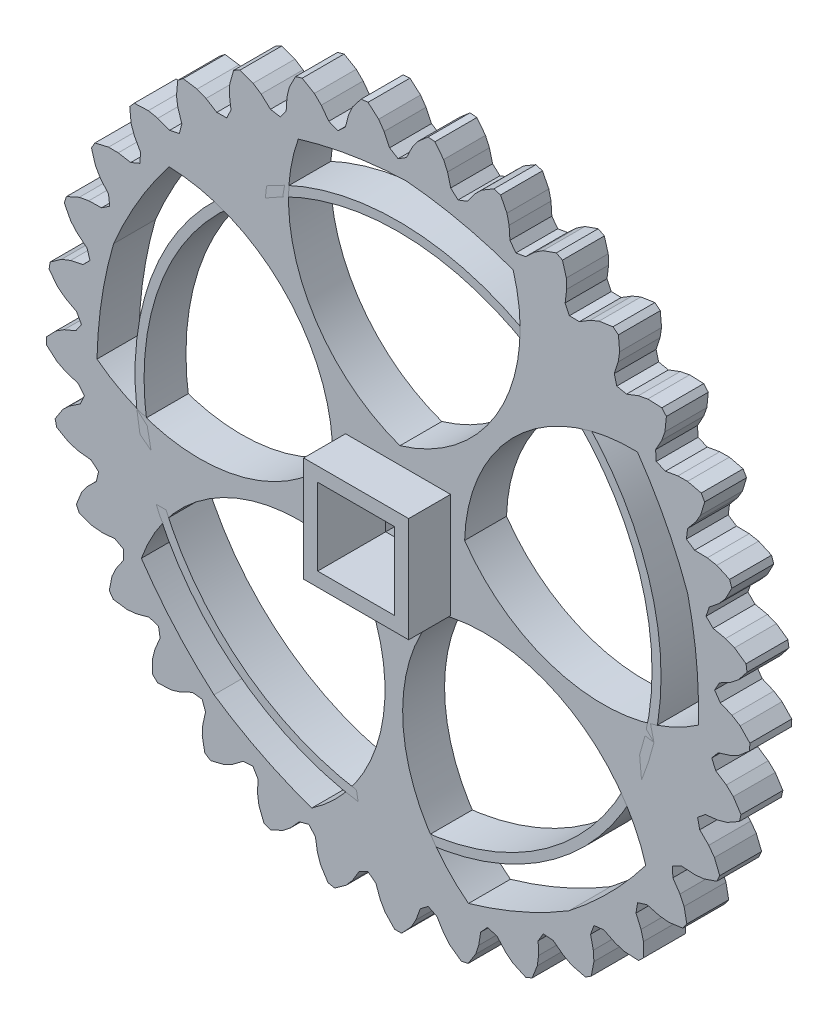
from build123d import *
from OCP.BRepFilletAPI import BRepFilletAPI_MakeChamfer

# Parameters (mm, degrees)
SKETCH1_R           = 33.61285714
SKETCH1_W           = 7.35
SKETCH1_H           = 7.35
BOSS_EXTRUDE1_DEPTH = 4
CUT_EXTRUDE1_DEPTH  = 48.703755934
CIRPATTERN1_COUNT   = 33
CUT_EXTRUDE2_DEPTH  = 48.686856373
SKETCH5_R           = 25.109802293
SKETCH5_R_2         = 24.249619568
BOSS_EXTRUDE2_DEPTH = 4
CIRPATTERN2_COUNT   = 5
CHAMFER1_SIZE       = 1.5
CHAMFER1_SIZE2      = 0.5
SKETCH6_W           = 10.02614
SKETCH6_H           = 10.02614
SKETCH6_W_2         = 7.35
SKETCH6_H_2         = 7.35
BOSS_EXTRUDE3_DEPTH = 4


with BuildPart() as part:
    # Sketch1 → Boss-Extrude1 (new body)
    with BuildSketch(Plane.XY):
        Circle(SKETCH1_R)
        Rectangle(SKETCH1_W, SKETCH1_H, mode=Mode.SUBTRACT)
    extrude(amount=BOSS_EXTRUDE1_DEPTH)

    # Sketch2 → Cut-Extrude1 (cut, through all)
    with BuildSketch(Plane.XY):
        Polygon((0, 30.26077862), (-0.806852748, 30.759138229), (-1.329964738, 31.848954875), (-1.855743872, 32.604561083), (-2.866453658, 33.490410695), (-1.855743872, 34.262942561), (0, 34.85886251), (1.855743872, 34.262942561), (2.866453658, 33.490410695), (1.855743872, 32.604561083), (1.329964738, 31.848954875), (0.806852748, 30.759138229), align=None)
    cut_extrude1 = extrude(amount=CUT_EXTRUDE1_DEPTH, mode=Mode.SUBTRACT)

    # CirPattern1: Cut-Extrude1 ×33 about axis
    cirpattern1_axis = Axis((0, 0, 0), (0, 0, 1))
    for i in range(1, CIRPATTERN1_COUNT):
        add(cut_extrude1.rotate(cirpattern1_axis, i * 360 / CIRPATTERN1_COUNT), mode=Mode.SUBTRACT)

    # Sketch4 → Cut-Extrude2 (cut, symmetric)
    with BuildSketch(Plane.XY):
        with BuildLine():
            ThreePointArc((0.785423622, 28.815229147), (-4.425906566, 28.309016937), (-9.526676446, 27.127340258))
            ThreePointArc((-9.526676446, 27.127340258), (-8.91966248, 14.864745864), (0.180524863, 6.623005904))
            ThreePointArc((0.180524863, 6.623005904), (9.716160759, 14.356784753), (10.990266096, 26.568105027))
            ThreePointArc((10.990266096, 26.568105027), (5.961440562, 28.025886521), (0.785423622, 28.815229147))
        make_face()
    cut_extrude2 = extrude(amount=CUT_EXTRUDE2_DEPTH, both=True, mode=Mode.SUBTRACT)

    # CirPattern2: Cut-Extrude2 ×5 about axis
    cirpattern2_axis = Axis((0, 0, 0), (0, 0, 1))
    for i in range(1, CIRPATTERN2_COUNT):
        add(cut_extrude2.rotate(cirpattern2_axis, i * 360 / CIRPATTERN2_COUNT), mode=Mode.SUBTRACT)

    # Chamfer1: one chamfer whose edges measure the first distance from different faces: ONE call of the kernel's chamfer builder (chamfer() names one face for all edges)
    chamfer1_edges_1 = [part.edges().sort_by_distance(p)[0] for p in [
        (-3.675, 0, 0),
    ]]
    chamfer1_side_1 = [part.faces().sort_by_distance(p)[0] for p in [
        (-3.675, 0, 2),
    ]]
    chamfer1_edges_2 = [part.edges().sort_by_distance(p)[0] for p in [
        (0, -3.675, 0),
    ]]
    chamfer1_side_2 = [part.faces().sort_by_distance(p)[0] for p in [
        (0, -3.675, 2),
    ]]
    chamfer1_edges_3 = [part.edges().sort_by_distance(p)[0] for p in [
        (3.675, 0, 0),
    ]]
    chamfer1_side_3 = [part.faces().sort_by_distance(p)[0] for p in [
        (3.675, 0, 2),
    ]]
    chamfer1_edges_4 = [part.edges().sort_by_distance(p)[0] for p in [
        (0, 3.675, 0),
    ]]
    chamfer1_side_4 = [part.faces().sort_by_distance(p)[0] for p in [
        (0, 3.675, 2),
    ]]
    chamfer1 = BRepFilletAPI_MakeChamfer(part.part.solid().wrapped)
    for e in chamfer1_edges_1:
        chamfer1.Add(CHAMFER1_SIZE, CHAMFER1_SIZE2, e.wrapped, chamfer1_side_1[0].wrapped)  # the first distance lies on this face
    for e in chamfer1_edges_2:
        chamfer1.Add(CHAMFER1_SIZE, CHAMFER1_SIZE2, e.wrapped, chamfer1_side_2[0].wrapped)  # the first distance lies on this face
    for e in chamfer1_edges_3:
        chamfer1.Add(CHAMFER1_SIZE, CHAMFER1_SIZE2, e.wrapped, chamfer1_side_3[0].wrapped)  # the first distance lies on this face
    for e in chamfer1_edges_4:
        chamfer1.Add(CHAMFER1_SIZE, CHAMFER1_SIZE2, e.wrapped, chamfer1_side_4[0].wrapped)  # the first distance lies on this face
    add(Compound.cast(chamfer1.Shape()), mode=Mode.REPLACE)

    # Sketch6 → Boss-Extrude3 (add)
    with BuildSketch(Plane.XY.offset(4)):
        Rectangle(SKETCH6_W, SKETCH6_H)
        Rectangle(SKETCH6_W_2, SKETCH6_H_2, mode=Mode.SUBTRACT)
    extrude(amount=BOSS_EXTRUDE3_DEPTH)


with BuildPart() as body_2:
    # Sketch5 → Boss-Extrude2 (new, through all)
    with BuildSketch(Plane.XY):
        Circle(SKETCH5_R)
        Circle(SKETCH5_R_2, mode=Mode.SUBTRACT)
    extrude(amount=BOSS_EXTRUDE2_DEPTH)


solid = Compound([part.part, body_2.part])
